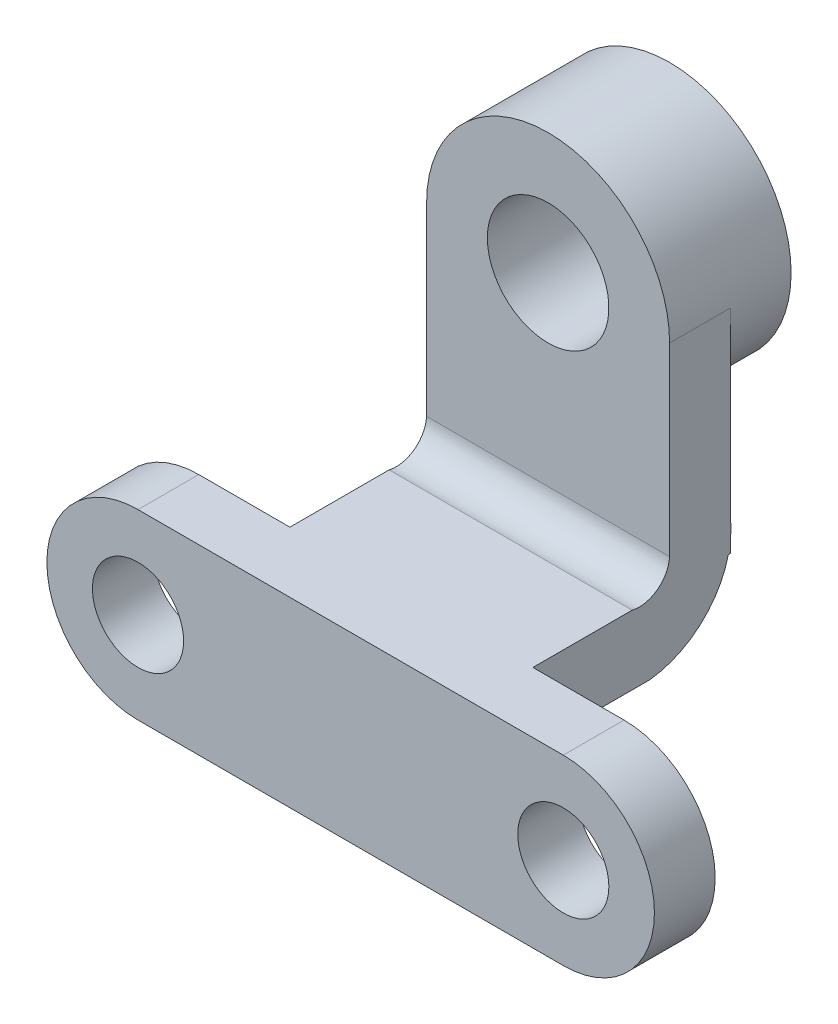
from build123d import *

# Parameters (mm, degrees)
SKETCH1_R           = 19.05
BOSS_EXTRUDE1_DEPTH = 25.4
SKETCH3_R           = 25.4
BOSS_EXTRUDE2_DEPTH = 25.4
SKETCH4_R           = 50.8
SKETCH4_R_2         = 25.4
BOSS_EXTRUDE3_DEPTH = 25.4
BOSS_EXTRUDE4_DEPTH = 101.6


with BuildPart() as part:
    # Sketch1 → Boss-Extrude1 (new body)
    with BuildSketch(Plane.XY):
        with BuildLine():
            Line((-78.509090909, 38.1), (99.290909091, 38.1))
            ThreePointArc((99.290909091, 38.1), (137.390909091, 0), (99.290909091, -38.1))
            Line((99.290909091, -38.1), (-78.509090909, -38.1))
            ThreePointArc((-78.509090909, -38.1), (-116.609090909, 0), (-78.509090909, 38.1))
        make_face()
        with Locations((-78.509090909, 0)):
            Circle(SKETCH1_R, mode=Mode.SUBTRACT)
        with Locations((99.290909091, 0)):
            Circle(SKETCH1_R, mode=Mode.SUBTRACT)
    extrude(amount=-BOSS_EXTRUDE1_DEPTH)



with BuildPart() as body_2:
    # Sketch3 → Boss-Extrude2 (new body)
    with BuildSketch(Plane(origin=(0, 0, -82.55), x_dir=(-1, 0, 0), z_dir=(0, 0, -1))):
        with BuildLine():
            Line((-61.190909091, 127), (-61.190909091, 38.1))
            Line((-61.190909091, 38.1), (40.409090909, 38.1))
            Line((40.409090909, 38.1), (40.409090909, 127))
            ThreePointArc((40.409090909, 127), (-10.390909091, 177.8), (-61.190909091, 127))
        make_face()
        with Locations((-10.390909091, 127)):
            Circle(SKETCH3_R, mode=Mode.SUBTRACT)
    extrude(amount=BOSS_EXTRUDE2_DEPTH)

    # Sketch4 → Boss-Extrude3 (add)
    with BuildSketch(Plane(origin=(0, 0, -107.95), x_dir=(-1, 0, 0), z_dir=(0, 0, -1))):
        with Locations((-10.390909091, 127)):
            Circle(SKETCH4_R)
        with Locations((-10.390909091, 127)):
            Circle(SKETCH4_R_2, mode=Mode.SUBTRACT)
    extrude(amount=BOSS_EXTRUDE3_DEPTH)


with BuildPart() as part_1:
    add(part.part)

    add(body_2.part)  # Boss-Extrude4 merges body 2
    # Sketch6 → Boss-Extrude4 (add)
    with BuildSketch(Plane(origin=(61.190909091, 0, 0), x_dir=(0, 0, -1), z_dir=(1, 0, 0))):
        with BuildLine():
            Line((25.4, 38.1), (66.869857518, 38.1))
            ThreePointArc((66.869857518, 38.1), (78.035050252, 40.707035383), (82.55, 51.246171546))
            Line((82.55, 51.246171546), (107.95, 51.246171546))
            ThreePointArc((107.95, 51.246171546), (99.806428385, 23.245891332), (74.248865658, 9.205078029))
            Line((74.248865658, 9.205078029), (25.4, 9.205078029))
            Line((25.4, 9.205078029), (25.4, 38.1))
        make_face()
    extrude(amount=-BOSS_EXTRUDE4_DEPTH)


solid = part_1.part
